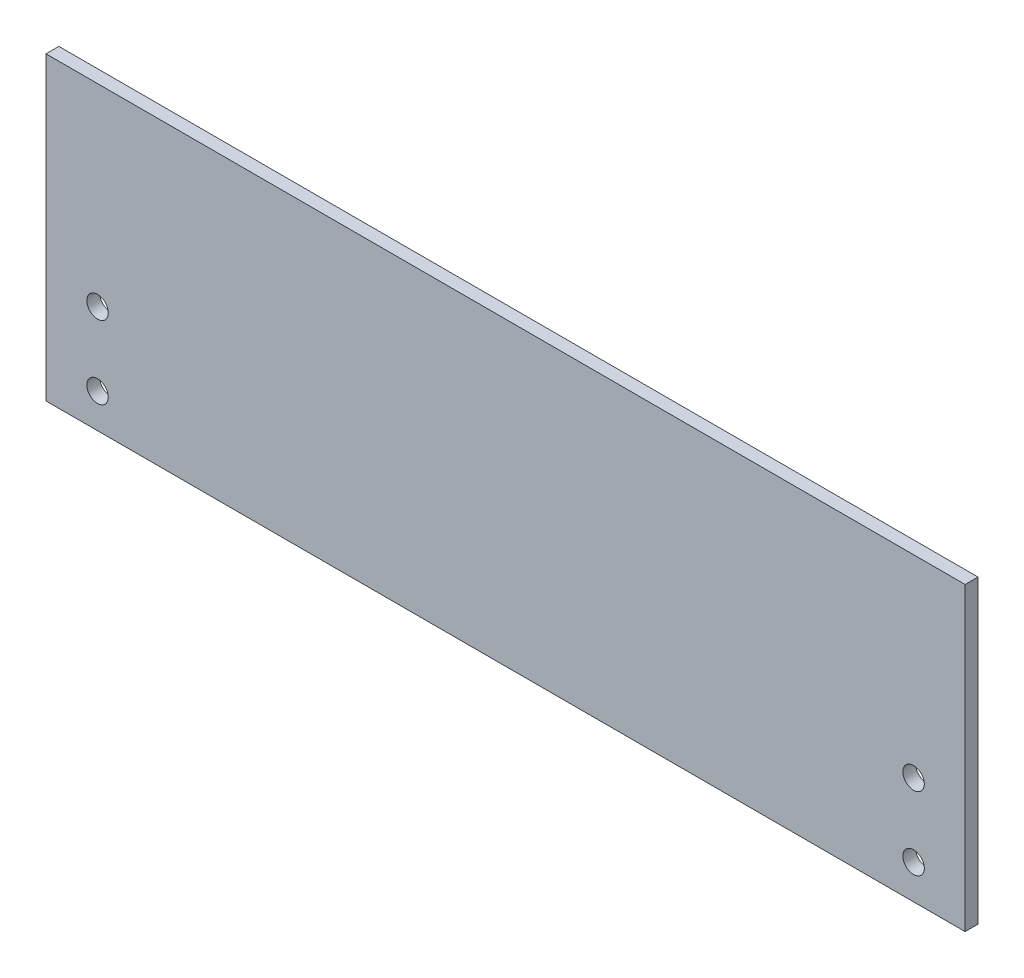
from build123d import *

# Parameters (mm, degrees)
SKETCH_1_W      = 214
SKETCH_1_H      = 70
SKETCH_1_R      = 2.5
EXTRUDE_1_DEPTH = 3


with BuildPart() as part:
    # 草图1 → 凸台-拉伸1 (new body)
    with BuildSketch(Plane.XY):
        Rectangle(SKETCH_1_W, SKETCH_1_H)
        with Locations((-95, -10)):
            Circle(SKETCH_1_R, mode=Mode.SUBTRACT)
        with Locations((-95, -27)):
            Circle(SKETCH_1_R, mode=Mode.SUBTRACT)
        with Locations(Location((95, -27, 0), (0, 0, 180))):
            Circle(SKETCH_1_R, mode=Mode.SUBTRACT)
        with Locations(Location((95, -10, 0), (0, 0, 180))):
            Circle(SKETCH_1_R, mode=Mode.SUBTRACT)
    extrude(amount=EXTRUDE_1_DEPTH)


solid = part.part
